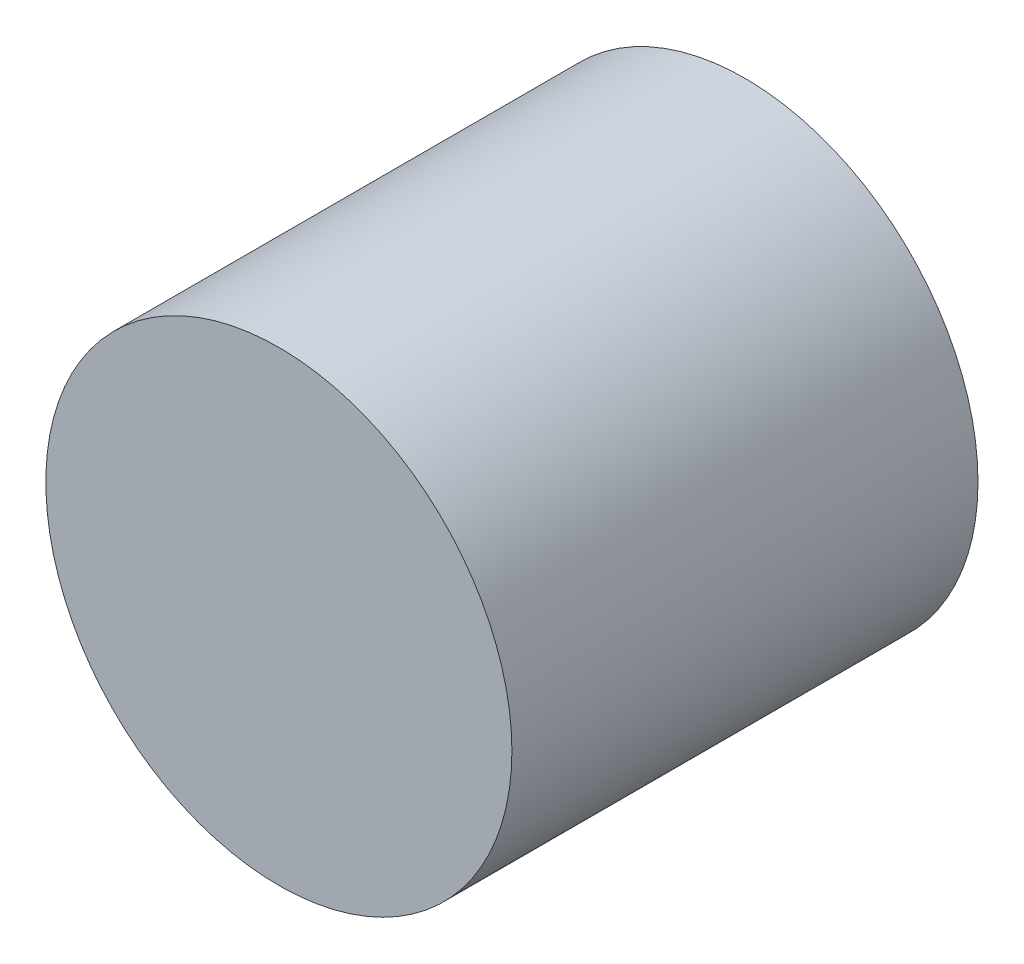
from build123d import *

# Parameters (mm, degrees)
SKETCH_1_R      = 12
EXTRUDE_1_DEPTH = 24


with BuildPart() as part:
    # 草图1 → 凸台-拉伸1 (new body)
    with BuildSketch(Plane.XY):
        Circle(SKETCH_1_R)
    extrude(amount=-EXTRUDE_1_DEPTH)


solid = part.part
